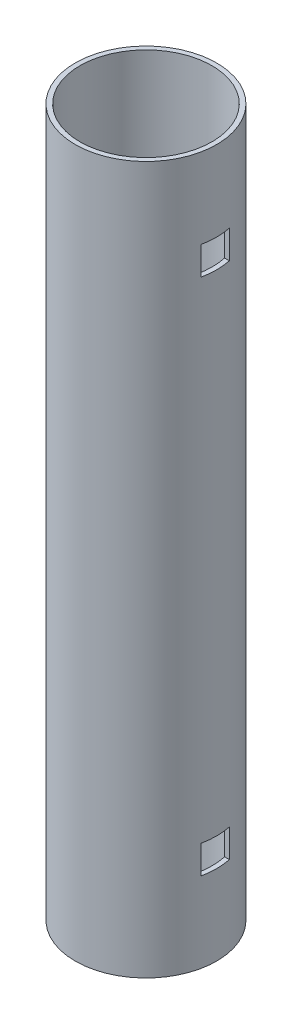
from build123d import *

# Parameters (mm, degrees)
SKETCH1_R           = 15
SKETCH1_R_2         = 14
BOSS_EXTRUDE1_DEPTH = 150
SKETCH2_W           = 6
SKETCH2_H           = 6
CUT_EXTRUDE1_DEPTH  = 15


with BuildPart() as part:
    # Sketch1 → Boss-Extrude1 (new body)
    with BuildSketch(Plane(origin=(0, 0, 0), x_dir=(1, 0, 0), z_dir=(0, 1, 0))):
        with Locations(Location((0, 0, 0), (0, 0, 270))):
            Circle(SKETCH1_R)
        with Locations(Location((0, 0, 0), (0, 0, 270))):
            Circle(SKETCH1_R_2, mode=Mode.SUBTRACT)
    extrude(amount=BOSS_EXTRUDE1_DEPTH)

    # Sketch2 → Cut-Extrude1 (cut, symmetric)
    with BuildSketch(Plane(origin=(0, 0, 0), x_dir=(0, 0, -1), z_dir=(1, 0, 0))):
        with Locations((0, 130)):
            Rectangle(SKETCH2_W, SKETCH2_H)
        with Locations((0, 20)):
            Rectangle(SKETCH2_W, SKETCH2_H)
    extrude(amount=CUT_EXTRUDE1_DEPTH, both=True, mode=Mode.SUBTRACT)


solid = part.part
